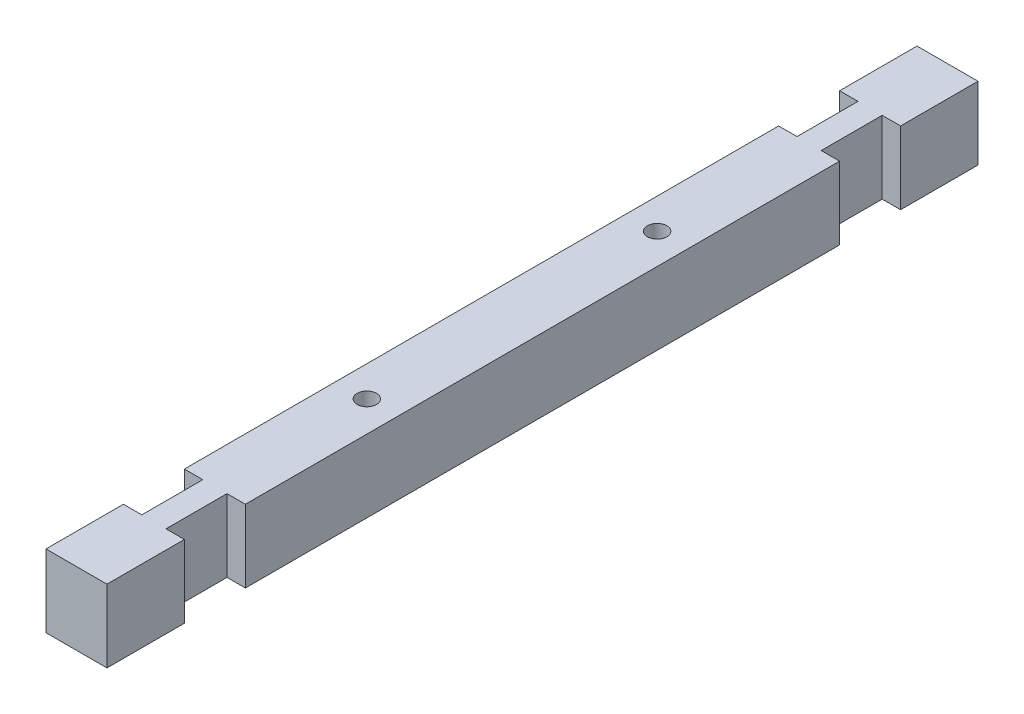
from build123d import *

# Parameters (mm, degrees)
ESQUISSE1_W             = 63
ESQUISSE1_H             = 75
BOSS_EXTRU_1_DEPTH      = 900
ESQUISSE2_W             = 63
ESQUISSE2_H             = 75
ENL_V_MAT_EXTRU_1_DEPTH = 19
ENL_V_START             = -63
ESQUISSE2_2_W           = 63
ESQUISSE2_2_H           = 75
ENL_V_MAT_EXTRU_2_DEPTH = 19
ESQUISSE3_R             = 10
ENL_V_MAT_EXTRU_3_DEPTH = 906.31431006


with BuildPart() as part:
    # Esquisse1 → Boss.-Extru.1 (new body)
    with BuildSketch(Plane.XY):
        with Locations((31.5, 37.5)):
            Rectangle(ESQUISSE1_W, ESQUISSE1_H)
    extrude(amount=BOSS_EXTRU_1_DEPTH)

    # Esquisse2 → Enlèv. mat.-Extru.1 (cut)
    with BuildSketch(Plane(origin=(63, 0, 0), x_dir=(0, 0, -1), z_dir=(1, 0, 0))):
        with Locations((-788.5, 37.5)):
            Rectangle(ESQUISSE2_W, ESQUISSE2_H)
        with Locations((-111.5, 37.5)):
            Rectangle(ESQUISSE2_W, ESQUISSE2_H)
    extrude(amount=-ENL_V_MAT_EXTRU_1_DEPTH, mode=Mode.SUBTRACT)

    # Esquisse2<2> → Enlèv. mat.-Extru.2 (cut)
    with BuildSketch(Plane(origin=(63, 0, 0), x_dir=(0, 0, -1), z_dir=(1, 0, 0)).offset(ENL_V_START)):
        with Locations((-788.5, 37.5)):
            Rectangle(ESQUISSE2_2_W, ESQUISSE2_2_H)
        with Locations((-111.5, 37.5)):
            Rectangle(ESQUISSE2_2_W, ESQUISSE2_2_H)
    extrude(amount=ENL_V_MAT_EXTRU_2_DEPTH, mode=Mode.SUBTRACT)

    # Esquisse3 → Enlèv. mat.-Extru.3 (cut, through all)
    with BuildSketch(Plane(origin=(0, 75, 0), x_dir=(1, 0, 0), z_dir=(0, 1, 0))):
        with Locations(Location((31.5, -300, 0), (0, 0, 270))):
            Circle(ESQUISSE3_R)
        with Locations(Location((31.5, -600, 0), (0, 0, 90))):
            Circle(ESQUISSE3_R)
    extrude(amount=-ENL_V_MAT_EXTRU_3_DEPTH, mode=Mode.SUBTRACT)


solid = part.part
